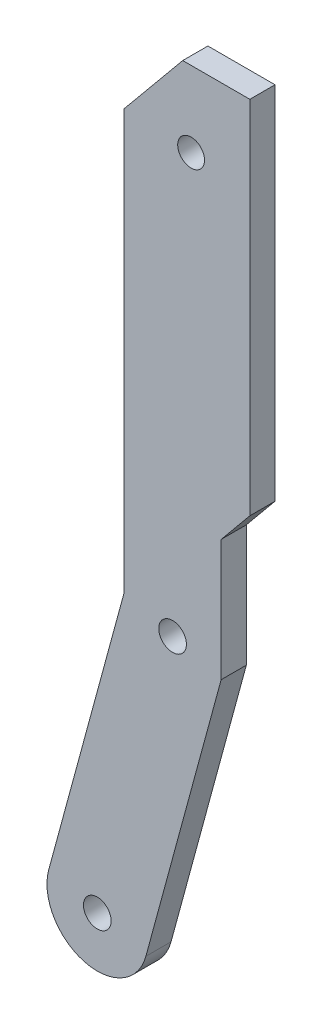
from build123d import *

# Parameters (mm, degrees)
SKETCH1_R           = 1.65
SKETCH1_R_2         = 1.6
BOSS_EXTRUDE1_DEPTH = 3


with BuildPart() as part:
    # Sketch1 → Boss-Extrude1 (new body)
    with BuildSketch(Plane.XY):
        with BuildLine():
            Line((-43.203651579, 6.54376887), (-34.230867434, 39.585145796))
            Line((-34.230867434, 39.585145796), (-34.230867434, 89.585145796))
            Line((-34.230867434, 89.585145796), (-27.230867434, 98.07042717))
            Line((-27.230867434, 98.07042717), (-19.230867434, 98.07042717))
            Line((-19.230867434, 98.07042717), (-19.230867434, 55.070526621))
            Line((-19.230867434, 55.070526621), (-22.650283011, 50.925569007))
            Line((-22.650283011, 50.925569007), (-22.650283011, 36.440298517))
            Line((-22.650283011, 36.440298517), (-31.623067155, 3.398921591))
            ThreePointArc((-31.623067155, 3.398921591), (-38.985783006, -0.818946981), (-43.203651579, 6.54376887))
        make_face()
        with Locations((-28.440575223, 38.012722157)):
            Circle(SKETCH1_R, mode=Mode.SUBTRACT)
        with Locations((-37.413359367, 4.97134523)):
            Circle(SKETCH1_R, mode=Mode.SUBTRACT)
        with Locations((-26.230867434, 89.07042717)):
            Circle(SKETCH1_R_2, mode=Mode.SUBTRACT)
    extrude(amount=BOSS_EXTRUDE1_DEPTH)


solid = part.part
